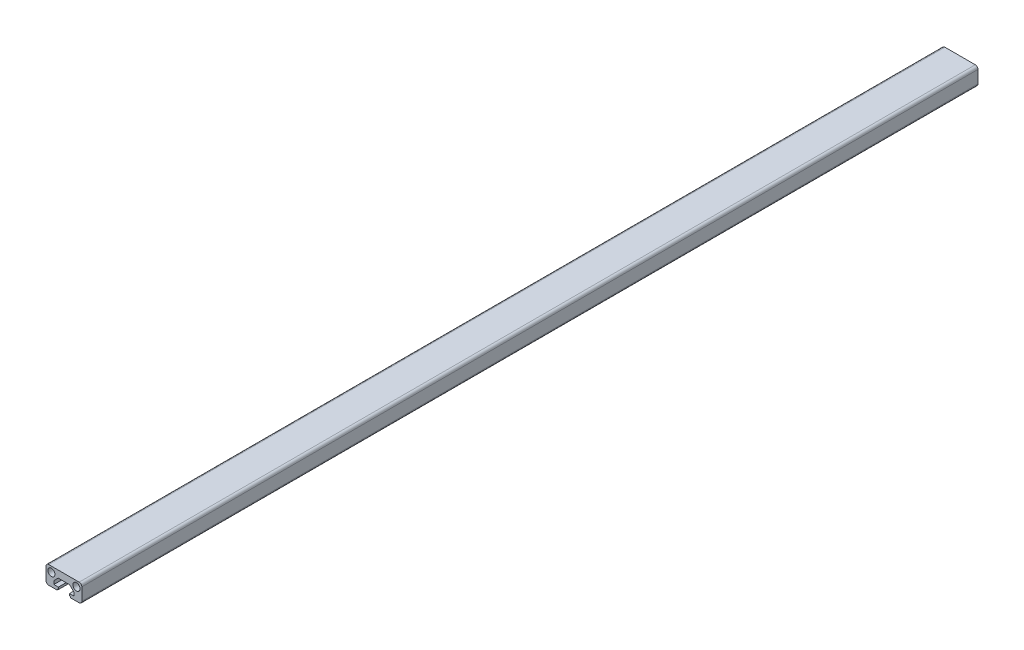
from build123d import *

# Parameters (mm, degrees)
SKETCH_1_R      = 2
EXTRUDE_1_DEPTH = 250


with BuildPart() as part:
    # 草图1 → 凸台-拉伸1 (new, symmetric)
    with BuildSketch(Plane.XY):
        with BuildLine():
            Line((-8.5, 0), (-3.95, 0))
            ThreePointArc((-3.95, 0), (-3.737867966, 0.087867966), (-3.65, 0.3))
            Line((-3.65, 0.3), (-3.65, 0.6))
            Line((-3.65, 0.6), (-3.1, 0.6))
            Line((-3.1, 0.6), (-3.1, 1.8))
            Line((-3.1, 1.8), (-5.6, 1.8))
            Line((-5.6, 1.8), (-5.6, 3.692893219))
            Line((-5.6, 3.692893219), (-3.192893219, 6.1))
            Line((-3.192893219, 6.1), (3.192893219, 6.1))
            Line((3.192893219, 6.1), (5.6, 3.692893219))
            Line((5.6, 3.692893219), (5.6, 1.8))
            Line((5.6, 1.8), (3.1, 1.8))
            Line((3.1, 1.8), (3.1, 0.6))
            Line((3.1, 0.6), (3.65, 0.6))
            Line((3.65, 0.6), (3.65, 0.3))
            ThreePointArc((3.65, 0.3), (3.737867966, 0.087867966), (3.95, 0))
            Line((3.95, 0), (8.5, 0))
            ThreePointArc((8.5, 0), (9.560660172, 0.439339828), (10, 1.5))
            Line((10, 1.5), (10, 8.5))
            ThreePointArc((10, 8.5), (9.560660172, 9.560660172), (8.5, 10))
            Line((8.5, 10), (-8.5, 10))
            ThreePointArc((-8.5, 10), (-9.560660172, 9.560660172), (-10, 8.5))
            Line((-10, 8.5), (-10, 1.5))
            ThreePointArc((-10, 1.5), (-9.560660172, 0.439339828), (-8.5, 0))
        make_face()
        with Locations((-7, 7)):
            Circle(SKETCH_1_R, mode=Mode.SUBTRACT)
        with Locations(Location((7, 7, 0), (0, 0, 180))):
            Circle(SKETCH_1_R, mode=Mode.SUBTRACT)
    extrude(amount=EXTRUDE_1_DEPTH, both=True)


solid = part.part
